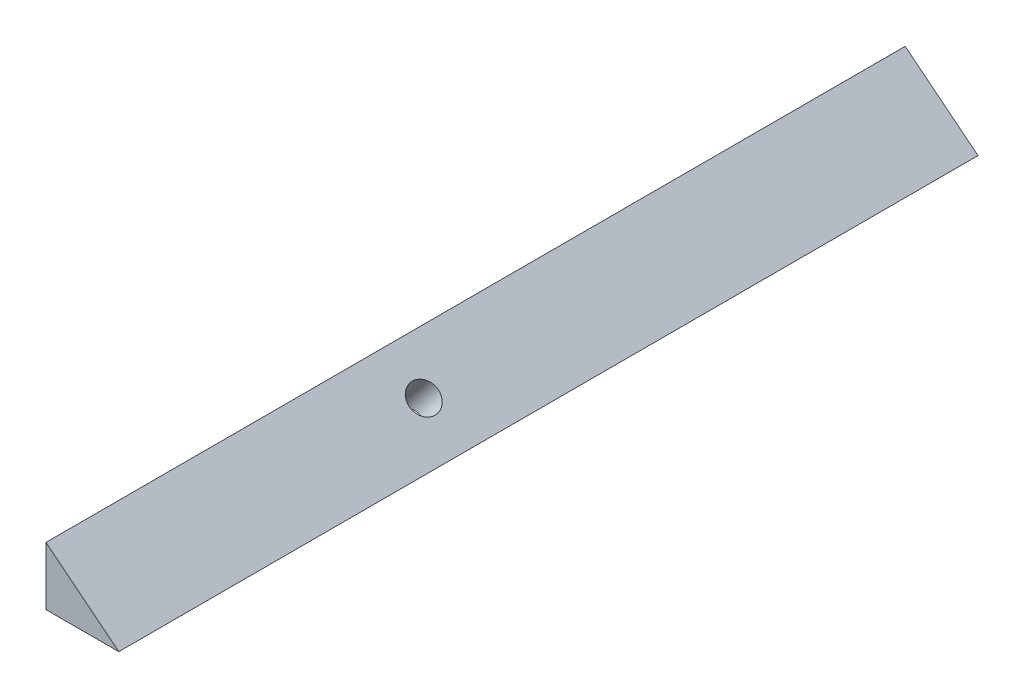
from build123d import *

# Parameters (mm, degrees)
BOSS_EXTRUDE1_DEPTH = 38.1
SKETCH2_R           = 12.7
CUT_EXTRUDE1_DEPTH  = 63.532383805
BOSS_EXTRUDE2_DEPTH = 279.4
BOSS_EXTRUDE3_DEPTH = 431.8


with BuildPart() as part:
    # Sketch1 → Boss-Extrude1 (new body)
    with BuildSketch(Plane.XY):
        Polygon((0, 0), (0, 50.8), (63.5, 0), align=None)
    extrude(amount=-BOSS_EXTRUDE1_DEPTH)

    # Sketch2 → Cut-Extrude1 (cut, through all)
    with BuildSketch(Plane(origin=(24.780487805, 30.975609756, 0), x_dir=(0.7808688094430303, -0.6246950475544244, 0), z_dir=(0.6246950475544244, 0.7808688094430304, 0))):
        with Locations(Location((7.971690031, 19.05, 0), (0, 0, 180))):
            Circle(SKETCH2_R)
    extrude(amount=-CUT_EXTRUDE1_DEPTH, mode=Mode.SUBTRACT)

    # Sketch3 → Boss-Extrude2 (add)
    with BuildSketch(Plane.XY):
        Polygon((0, 50.8), (0, 0), (63.5, 0), align=None)
    extrude(amount=BOSS_EXTRUDE2_DEPTH)

    # Sketch4 → Boss-Extrude3 (add)
    with BuildSketch(Plane(origin=(0, 0, -38.1), x_dir=(-1, 0, 0), z_dir=(0, 0, -1))):
        Polygon((0, 50.8), (-63.5, 0), (0, 0), align=None)
    extrude(amount=BOSS_EXTRUDE3_DEPTH)


solid = part.part
